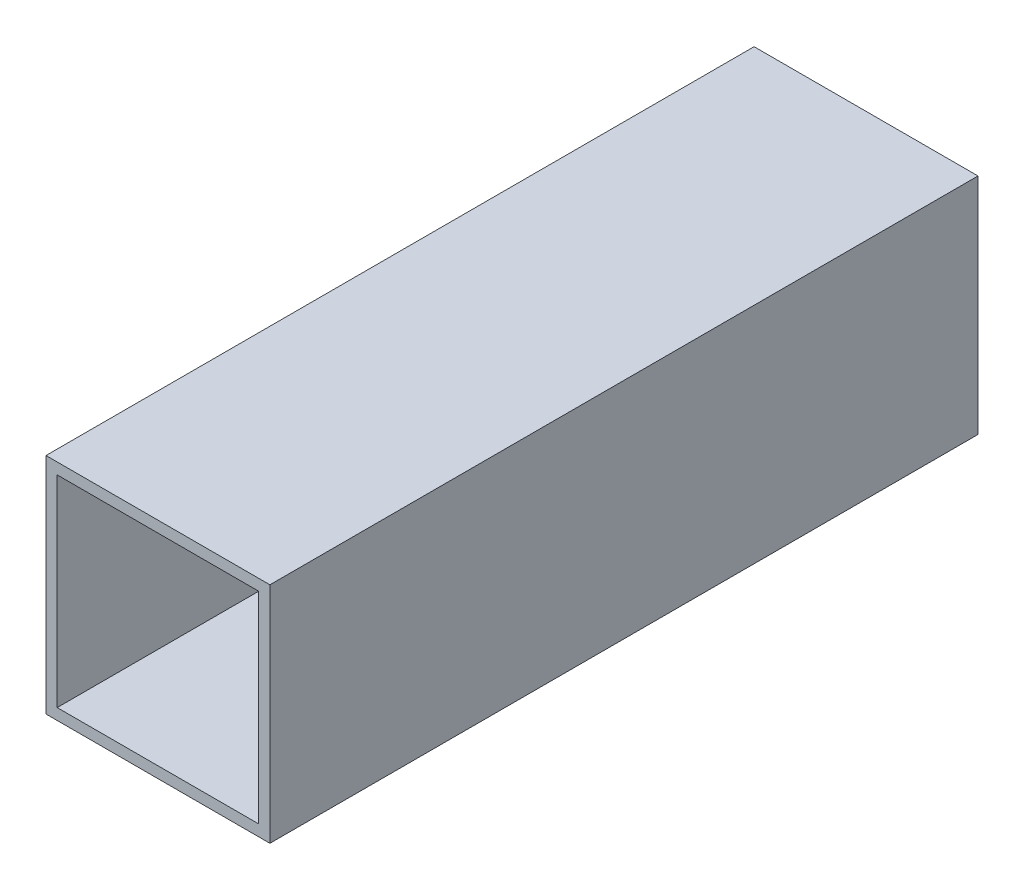
from build123d import *

# Parameters (mm, degrees)
CROQUIS1_W            = 40
CROQUIS1_H            = 40
CROQUIS1_W_2          = 36
CROQUIS1_H_2          = 36
EXTRUIR_L_MINA1_DEPTH = 126.5


with BuildPart() as part:
    # Croquis1 → Extruir-Lámina1 (new body)
    with BuildSketch(Plane.XY):
        Rectangle(CROQUIS1_W, CROQUIS1_H)
        Rectangle(CROQUIS1_W_2, CROQUIS1_H_2, mode=Mode.SUBTRACT)
    extrude(amount=EXTRUIR_L_MINA1_DEPTH)


solid = part.part
